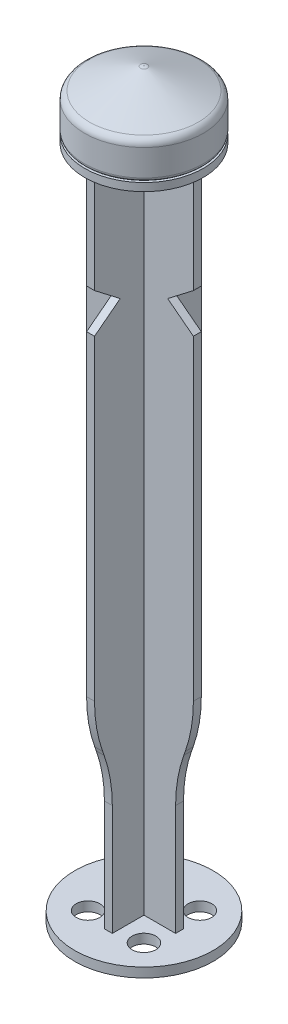
from build123d import *

# Parameters (mm, degrees)
SKETCH1_R           = 8.75
BOSS_EXTRUDE1_DEPTH = 1.2
BOSS_EXTRUDE2_DEPTH = 0.5
CIRPATTERN1_COUNT   = 4
SKETCH4_R           = 7.5
BOSS_EXTRUDE3_DEPTH = 1
CUT_EXTRUDE1_REACH  = 96.514
SKETCH6_R           = 1.5
CIRPATTERN2_COUNT   = 4


with BuildPart() as part:
    # Sketch1 → Boss-Extrude1 (new body)
    with BuildSketch(Plane(origin=(0, 0, 0), x_dir=(1, 0, 0), z_dir=(0, 1, 0))):
        with Locations(Location((0, 0, 0), (0, 0, 270))):
            Circle(SKETCH1_R)
    extrude(amount=BOSS_EXTRUDE1_DEPTH)

    # Sketch3 → Boss-Extrude2 (add, symmetric)
    with BuildSketch(Plane(origin=(0, 0, 0), x_dir=(0, 0, -1), z_dir=(1, 0, 0))):
        with BuildLine():
            Line((0, 1.2), (0, 85.2))
            Line((0, 85.2), (6.75, 85.2))
            Line((6.75, 85.2), (6.75, 72.7))
            Line((6.75, 72.7), (3.5, 70.2))
            Line((3.5, 70.2), (6.75, 67.7))
            Line((6.75, 67.7), (6.75, 27.739908728))
            ThreePointArc((6.75, 27.739908728), (6.490167531, 24.69254003), (5.718171558, 21.733149703))
            Line((5.718171558, 21.733149703), (5.531828442, 21.206759025))
            ThreePointArc((5.531828442, 21.206759025), (4.759832469, 18.247368698), (4.5, 15.2))
            Line((4.5, 15.2), (4.5, 1.2))
            Line((4.5, 1.2), (0, 1.2))
        make_face()
    boss_extrude2 = extrude(amount=BOSS_EXTRUDE2_DEPTH, both=True)

    # CirPattern1: Boss-Extrude2 ×4 about axis
    cirpattern1_axis = Axis((0, 0, 0), (0, 1, 0))
    for i in range(1, CIRPATTERN1_COUNT):
        add(boss_extrude2.rotate(cirpattern1_axis, i * 360 / CIRPATTERN1_COUNT))

    # Sketch4 → Boss-Extrude3 (add)
    with BuildSketch(Plane(origin=(0, 85.2, 0), x_dir=(1, 0, 0), z_dir=(0, 1, 0))):
        with Locations(Location((0, 0, 0), (0, 0, 270))):
            Circle(SKETCH4_R)
    extrude(amount=BOSS_EXTRUDE3_DEPTH)

    # Sketch5 → Revolve1 (revolve)
    with BuildSketch(Plane(origin=(0, 0, 0), x_dir=(0, 0, -1), z_dir=(1, 0, 0)), mode=Mode.PRIVATE) as revolve1_sk:
        with BuildLine():
            Line((0, 86.2), (7, 86.2))
            ThreePointArc((7, 86.2), (7.353553391, 86.346446609), (7.5, 86.7))
            Line((7.5, 86.7), (7.5, 90.031561736))
            ThreePointArc((7.5, 90.031561736), (7.331369891, 90.587281183), (6.882351793, 90.955578569))
            Line((6.882351793, 90.955578569), (0.433625988, 93.624016832))
            ThreePointArc((0.433625988, 93.624016832), (0.246188494, 93.680820277), (0.051274196, 93.7))
            Line((0.051274196, 93.7), (0, 93.7))
            Line((0, 93.7), (0, 86.2))
        make_face()
    revolve(revolve1_sk.sketch.rotate(Axis((0, 93.7, 0), (0, -1, 0)), 180), axis=Axis((0, 93.7, 0), (0, -1, 0)))

    # Sketch6 → Cut-Extrude1 (cut, up to next)
    with BuildSketch(Plane.XZ, mode=Mode.PRIVATE) as cut_extrude1_sk1:
        with Locations(Location((3.535533906, -3.535533906, 0), (0, 0, 270))):
            Circle(SKETCH6_R)
    cut_extrude1_tool1 = extrude(cut_extrude1_sk1.sketch, amount=-CUT_EXTRUDE1_REACH, mode=Mode.PRIVATE) & part.part
    cut_extrude1 = cut_extrude1_tool1.solids().sort_by_distance((3.535534, 0, -3.535534))[0]
    add(cut_extrude1, mode=Mode.SUBTRACT)

    # CirPattern2: Cut-Extrude1 ×4 about axis
    cirpattern2_axis = Axis((0, 0, 0), (0, 1, 0))
    for i in range(1, CIRPATTERN2_COUNT):
        add(cut_extrude1.rotate(cirpattern2_axis, i * 360 / CIRPATTERN2_COUNT), mode=Mode.SUBTRACT)


solid = part.part
